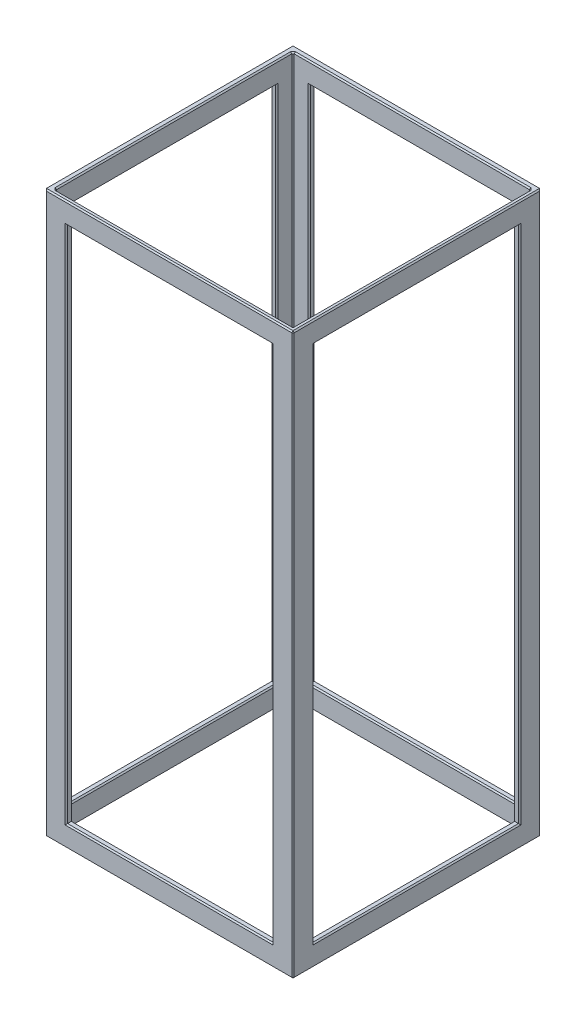
from build123d import *

# Parameters (mm, degrees)
SKETCH2_W           = 100
SKETCH2_H           = 100
BOSS_EXTRUDE1_DEPTH = 226.3
SHELL1_T            = -2
SKETCH3_W           = 83
SKETCH3_H           = 209.3
CUT_EXTRUDE1_DEPTH  = 253.411746953
SKETCH5_W           = 83
SKETCH5_H           = 209.3
CUT_EXTRUDE2_DEPTH  = 253.411746953
CHAMFER1_SIZE       = 0.5


with BuildPart() as part:
    # Sketch2 → Boss-Extrude1 (new body)
    with BuildSketch(Plane(origin=(0, 0, 0), x_dir=(1, 0, 0), z_dir=(0, 1, 0))):
        Rectangle(SKETCH2_W, SKETCH2_H)
    extrude(amount=BOSS_EXTRUDE1_DEPTH)

    # Shell1
    shell1_openings = [part.faces().sort_by_distance(p)[0] for p in [
        (0, 226.3, 0),
        (0, 0, 0),
    ]]
    offset(amount=SHELL1_T, openings=shell1_openings, kind=Kind.INTERSECTION)

    # Sketch3 → Cut-Extrude1 (cut, through all)
    with BuildSketch(Plane.XY.offset(50)):
        with Locations((0, 113.15)):
            Rectangle(SKETCH3_W, SKETCH3_H)
    extrude(amount=-CUT_EXTRUDE1_DEPTH, mode=Mode.SUBTRACT)

    # Sketch5 → Cut-Extrude2 (cut, through all)
    with BuildSketch(Plane(origin=(50, 0, 0), x_dir=(0, 0, -1), z_dir=(1, 0, 0))):
        with Locations((0, 113.15)):
            Rectangle(SKETCH5_W, SKETCH5_H)
    extrude(amount=-CUT_EXTRUDE2_DEPTH, mode=Mode.SUBTRACT)

    # Chamfer1
    chamfer1_edges = [part.edges().sort_by_distance(p)[0] for p in [
        (0, 226.3, 50),
        (48, 0, 0),
        (0, 0, -48),
        (48, 113.15, -48),
        (-48, 0, 0),
        (-48, 113.15, -48),
        (0, 0, 48),
        (-48, 113.15, 48),
        (48, 226.3, 0),
        (0, 226.3, -48),
        (-48, 226.3, 0),
        (0, 226.3, 48),
        (41.5, 113.15, -48),
        (0, 8.5, -48),
        (-41.5, 113.15, -48),
        (0, 217.8, -48),
        (41.5, 113.15, 50),
        (0, 217.8, 50),
        (-41.5, 113.15, 50),
        (0, 8.5, 50),
        (50, 226.3, 0),
        (0, 0, 50),
        (-48, 217.8, 0),
        (-48, 113.15, 41.5),
        (-48, 8.5, 0),
        (-48, 113.15, -41.5),
        (50, 0, 0),
        (50, 113.15, -41.5),
        (50, 217.8, 0),
        (50, 113.15, 41.5),
        (50, 8.5, 0),
        (50, 113.15, 50),
        (-50, 113.15, 50),
        (50, 113.15, -50),
    ]]
    chamfer(chamfer1_edges, length=CHAMFER1_SIZE)


solid = part.part
